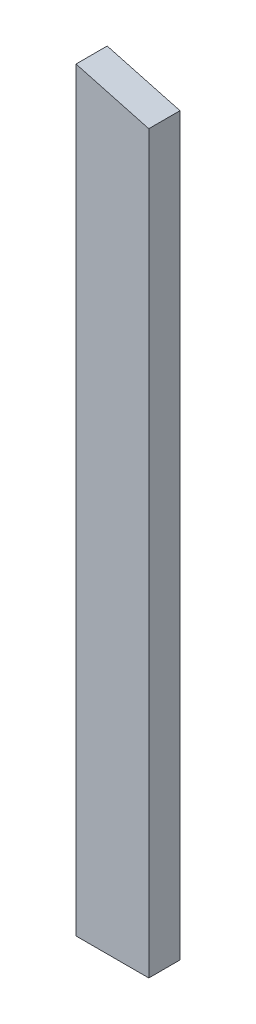
from build123d import *

# Parameters (mm, degrees)
BOSS_EXTRUDE1_DEPTH = 38.1


with BuildPart() as part:
    # Sketch1 → Boss-Extrude1 (new body)
    with BuildSketch(Plane.XY):
        Polygon((-730.83449825, 34.196787186), (-641.93449825, 34.196787186), (-641.93449825, 932.719110193), (-730.83449825, 956.692143901), align=None)
    extrude(amount=BOSS_EXTRUDE1_DEPTH)


solid = part.part
